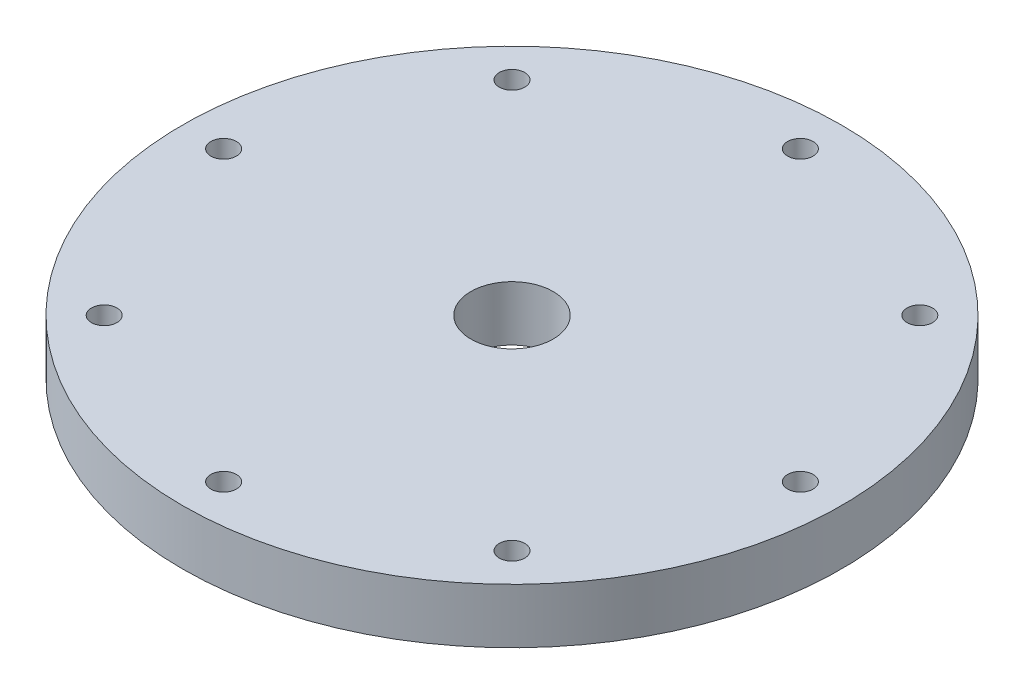
from build123d import *

# Parameters (mm, degrees)
SKETCH1_R                                      = 38.1
BOSS_EXTRUDE1_DEPTH                            = 6.35
CBORE_FOR_4_BUTTON_HEAD_CAP_SCREW1_D           = 2.9464
CBORE_FOR_4_BUTTON_HEAD_CAP_SCREW1_CBORE_D     = 5.715
CBORE_FOR_4_BUTTON_HEAD_CAP_SCREW1_CBORE_DEPTH = 1.4986
CIRPATTERN1_COUNT                              = 8
SKETCH8_R                                      = 4.7625
CUT_EXTRUDE1_DEPTH                             = 55.254423783


with BuildPart() as part:
    # Sketch1 → Boss-Extrude1 (new body)
    with BuildSketch(Plane(origin=(0, 0, 0), x_dir=(1, 0, 0), z_dir=(0, 1, 0))):
        with Locations(Location((0, 0, 0), (0, 0, 270))):
            Circle(SKETCH1_R)
    extrude(amount=BOSS_EXTRUDE1_DEPTH)

    # CBORE for #4 Button Head Cap Screw1 (through all)
    with Locations(Plane(origin=(0, 0, 0), x_dir=(-1, 0, 0), z_dir=(0, -1, 0))):
        with Locations((0, -33.3375)):
            cbore_for_4_button_head_cap_screw1 = CounterBoreHole(CBORE_FOR_4_BUTTON_HEAD_CAP_SCREW1_D / 2, CBORE_FOR_4_BUTTON_HEAD_CAP_SCREW1_CBORE_D / 2, CBORE_FOR_4_BUTTON_HEAD_CAP_SCREW1_CBORE_DEPTH)

    # CirPattern1: CBORE for #4 Button Head Cap Screw1 ×8 about axis
    cirpattern1_axis = Axis((0, 0, 0), (0, 1, 0))
    for i in range(1, CIRPATTERN1_COUNT):
        add(cbore_for_4_button_head_cap_screw1.rotate(cirpattern1_axis, i * 360 / CIRPATTERN1_COUNT), mode=Mode.SUBTRACT)

    # Sketch8 → Cut-Extrude1 (cut, through all)
    with BuildSketch(Plane.XZ):
        with Locations(Location((0, 0, 0), (0, 0, 270))):
            Circle(SKETCH8_R)
    extrude(amount=-CUT_EXTRUDE1_DEPTH, mode=Mode.SUBTRACT)


solid = part.part
